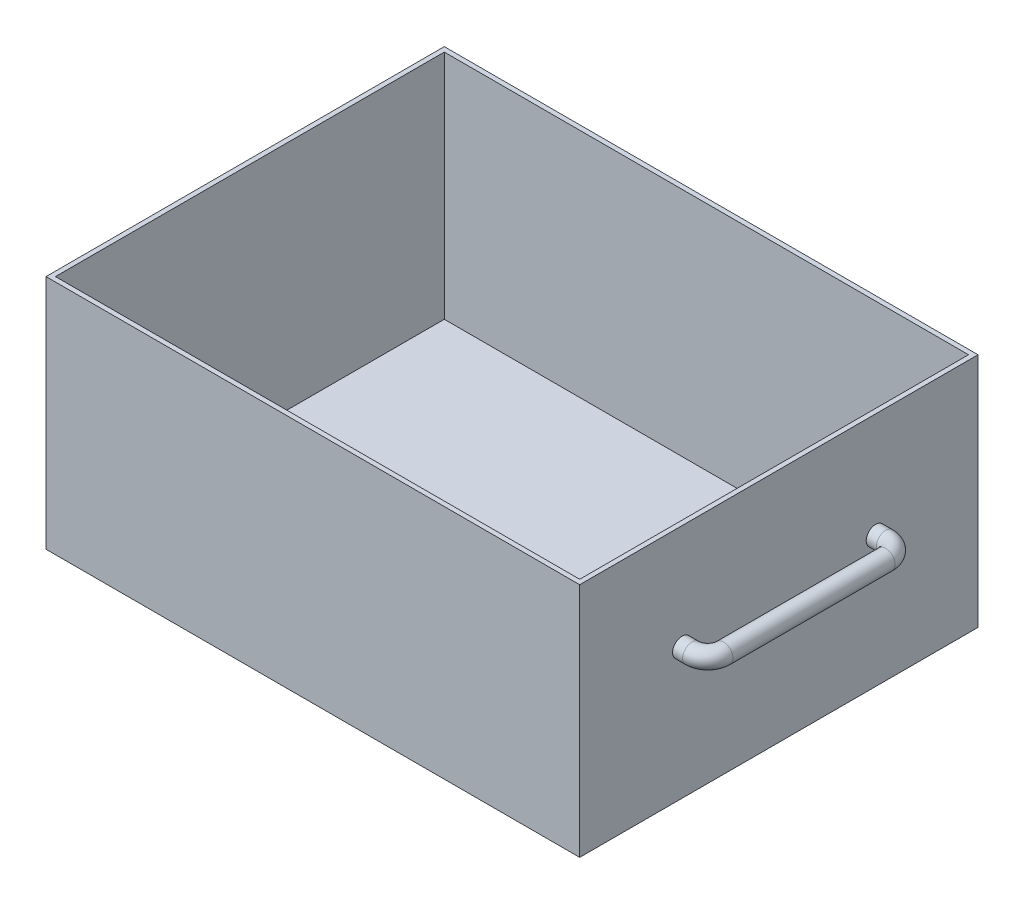
from build123d import *

# Parameters (mm, degrees)
SKETCH1_W           = 339
SKETCH1_H           = 253
BOSS_EXTRUDE1_DEPTH = 150
SHELL1_T            = -3
SKETCH2_R           = 6


with BuildPart() as part:
    # Sketch1 → Boss-Extrude1 (new body)
    with BuildSketch(Plane(origin=(0, 0, 0), x_dir=(1, 0, 0), z_dir=(0, 1, 0))):
        with Locations((-6.320083682, -6.625523013)):
            Rectangle(SKETCH1_W, SKETCH1_H)
    extrude(amount=BOSS_EXTRUDE1_DEPTH)

    # Shell1
    shell1_openings = [part.faces().sort_by_distance(p)[0] for p in [
        (-6.320083682, 150, 6.625523013),
    ]]
    offset(amount=SHELL1_T, openings=shell1_openings, kind=Kind.INTERSECTION)

    # Sweep2: sweep along a path in Sketch4
    with BuildLine(Plane(origin=(0, 83.172395684, 0), x_dir=(1, 0, 0), z_dir=(0, 1, 0))) as sweep2_path:
        Line((163.179916318, -68.125523013), (169.565605174, -68.125523013))
        ThreePointArc((169.565605174, -68.125523013), (176.636672985, -65.196590824), (179.565605174, -58.125523013))
        Line((179.565605174, -58.125523013), (179.565605174, 44.874476987))
        ThreePointArc((179.565605174, 44.874476987), (176.636672985, 51.945544799), (169.565605174, 54.874476987))
        Line((169.565605174, 54.874476987), (163.179916318, 54.874476987))
    # Sketch2 → Sweep2 (sweep)
    with BuildSketch(Plane(origin=(163.179916318, 0, 0), x_dir=(0, 0, -1), z_dir=(1, 0, 0))):
        with Locations((-68.125523013, 83.172395684)):
            Circle(SKETCH2_R)
    sweep(path=sweep2_path.line)


solid = part.part
